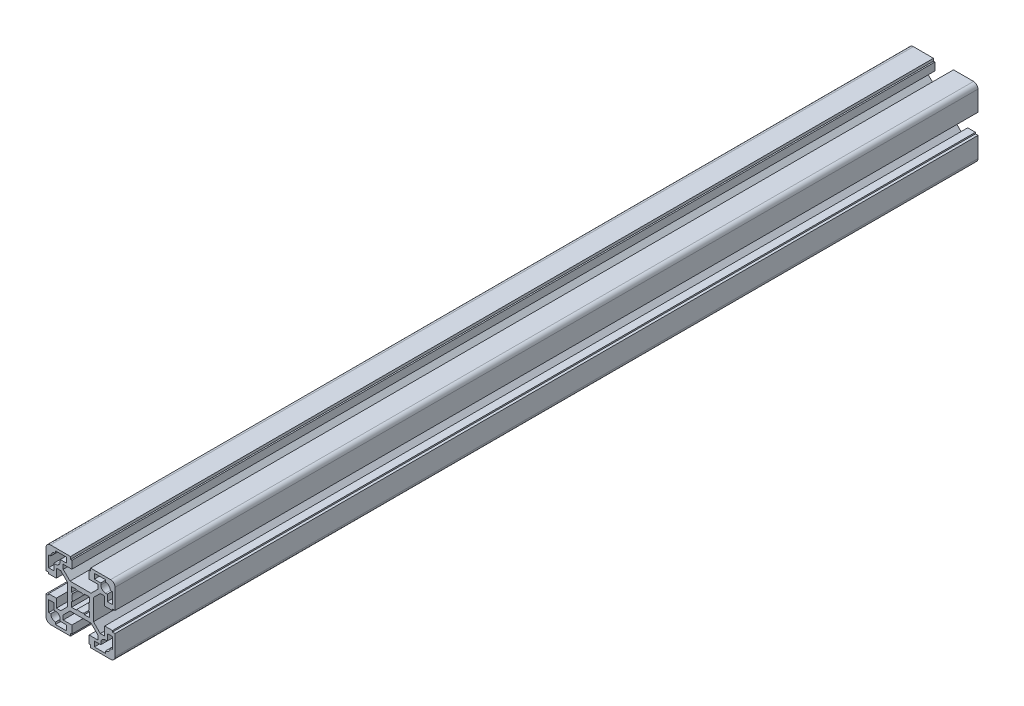
from build123d import *

# Parameters (mm, degrees)
ESTRUSIONE_ESTRUSIONE1_DEPTH = 500


with BuildPart() as part:
    # Schizzo1 → Estrusione-Estrusione1 (new body)
    with BuildSketch(Plane.XY):
        with BuildLine():
            Line((-5, 18.5), (-5, 14))
            Line((-5, 14), (-10.058726211, 14))
            Line((-10.058726211, 14), (-10.058726211, 11.46))
            Line((-10.058726211, 11.46), (-6.085, 7.5))
            Line((-6.085, 7.5), (6.085, 7.5))
            Line((6.085, 7.5), (10.058726211, 11.46))
            Line((10.058726211, 11.46), (10.058726211, 14))
            Line((10.058726211, 14), (5, 14))
            Line((5, 14), (5, 18.5))
            Line((5, 18.5), (5.8, 18.5))
            Line((5.8, 18.5), (5.8, 20))
            Line((5.8, 20), (17.4314, 20))
            ThreePointArc((17.4314, 20), (19.247674478, 19.247674478), (20, 17.4314))
            Line((20, 17.4314), (20, 5.8))
            Line((20, 5.8), (18.5, 5.8))
            Line((18.5, 5.8), (18.5, 5))
            Line((18.5, 5), (14, 5))
            Line((14, 5), (14, 10.058726211))
            Line((14, 10.058726211), (11.46, 10.058726211))
            Line((11.46, 10.058726211), (7.5, 6.085))
            Line((7.5, 6.085), (7.5, -6.085))
            Line((7.5, -6.085), (11.46, -10.058726211))
            Line((11.46, -10.058726211), (14, -10.058726211))
            Line((14, -10.058726211), (14, -5))
            Line((14, -5), (18.5, -5))
            Line((18.5, -5), (18.5, -5.8))
            Line((18.5, -5.8), (20, -5.8))
            Line((20, -5.8), (20, -17.4314))
            ThreePointArc((20, -17.4314), (19.247674478, -19.247674478), (17.4314, -20))
            Line((17.4314, -20), (5.8, -20))
            Line((5.8, -20), (5.8, -18.5))
            Line((5.8, -18.5), (5, -18.5))
            Line((5, -18.5), (5, -14))
            Line((5, -14), (10.058726211, -14))
            Line((10.058726211, -14), (10.058726211, -11.46))
            Line((10.058726211, -11.46), (6.085, -7.5))
            Line((6.085, -7.5), (-6.085, -7.5))
            Line((-6.085, -7.5), (-10.058726211, -11.46))
            Line((-10.058726211, -11.46), (-10.058726211, -14))
            Line((-10.058726211, -14), (-5, -14))
            Line((-5, -14), (-5, -18.5))
            Line((-5, -18.5), (-5.8, -18.5))
            Line((-5.8, -18.5), (-5.8, -20))
            Line((-5.8, -20), (-17.4314, -20))
            ThreePointArc((-17.4314, -20), (-19.247674478, -19.247674478), (-20, -17.4314))
            Line((-20, -17.4314), (-20, -5.8))
            Line((-20, -5.8), (-18.5, -5.8))
            Line((-18.5, -5.8), (-18.5, -5))
            Line((-18.5, -5), (-14, -5))
            Line((-14, -5), (-14, -10.058726211))
            Line((-14, -10.058726211), (-11.46, -10.058726211))
            Line((-11.46, -10.058726211), (-7.5, -6.085))
            Line((-7.5, -6.085), (-7.5, 6.085))
            Line((-7.5, 6.085), (-11.46, 10.058726211))
            Line((-11.46, 10.058726211), (-14, 10.058726211))
            Line((-14, 10.058726211), (-14, 5))
            Line((-14, 5), (-18.5, 5))
            Line((-18.5, 5), (-18.5, 5.8))
            Line((-18.5, 5.8), (-20, 5.8))
            Line((-20, 5.8), (-20, 17.4314))
            ThreePointArc((-20, 17.4314), (-19.247674478, 19.247674478), (-17.4314, 20))
            Line((-17.4314, 20), (-5.8, 20))
            Line((-5.8, 20), (-5.8, 18.5))
            Line((-5.8, 18.5), (-5, 18.5))
        make_face()
        with BuildLine():
            Line((-5.2, 5.2), (-2.26, 5.2))
            Line((-2.26, 5.2), (-1.992985622, 4.585630634))
            ThreePointArc((-1.992985622, 4.585630634), (0, 5), (1.992985622, 4.585630634))
            Line((1.992985622, 4.585630634), (2.26, 5.2))
            Line((2.26, 5.2), (5.2, 5.2))
            Line((5.2, 5.2), (5.2, 2.26))
            Line((5.2, 2.26), (4.585630634, 1.992985622))
            ThreePointArc((4.585630634, 1.992985622), (5, 0), (4.585630634, -1.992985622))
            Line((4.585630634, -1.992985622), (5.2, -2.26))
            Line((5.2, -2.26), (5.2, -5.2))
            Line((5.2, -5.2), (2.26, -5.2))
            Line((2.26, -5.2), (1.992985622, -4.585630634))
            ThreePointArc((1.992985622, -4.585630634), (0, -5), (-1.992985622, -4.585630634))
            Line((-1.992985622, -4.585630634), (-2.26, -5.2))
            Line((-2.26, -5.2), (-5.2, -5.2))
            Line((-5.2, -5.2), (-5.2, -2.26))
            Line((-5.2, -2.26), (-4.585630634, -1.992985622))
            ThreePointArc((-4.585630634, -1.992985622), (-5, 0), (-4.585630634, 1.992985622))
            Line((-4.585630634, 1.992985622), (-5.2, 2.26))
            Line((-5.2, 2.26), (-5.2, 5.2))
        make_face(mode=Mode.SUBTRACT)
        with BuildLine():
            Line((-11.75, 15.5), (-11.75, 14.5))
            ThreePointArc((-11.75, 14.5), (-12.555456352, 12.555456352), (-14.5, 11.75))
            Line((-14.5, 11.75), (-15.5, 11.75))
            Line((-15.5, 11.75), (-15.5, 8))
            Line((-15.5, 8), (-18.5, 8))
            Line((-18.5, 8), (-18.5, 14.5))
            Line((-18.5, 14.5), (-17.25, 14.5))
            ThreePointArc((-17.25, 14.5), (-16.444543648, 16.444543648), (-14.5, 17.25))
            Line((-14.5, 17.25), (-14.5, 18.5))
            Line((-14.5, 18.5), (-8, 18.5))
            Line((-8, 18.5), (-8, 15.5))
            Line((-8, 15.5), (-11.75, 15.5))
        make_face(mode=Mode.SUBTRACT)
        with BuildLine():
            Line((15.5, 11.75), (14.5, 11.75))
            ThreePointArc((14.5, 11.75), (12.555456352, 12.555456352), (11.75, 14.5))
            Line((11.75, 14.5), (11.75, 15.5))
            Line((11.75, 15.5), (8, 15.5))
            Line((8, 15.5), (8, 18.5))
            Line((8, 18.5), (14.5, 18.5))
            Line((14.5, 18.5), (14.5, 17.25))
            ThreePointArc((14.5, 17.25), (16.444543648, 16.444543648), (17.25, 14.5))
            Line((17.25, 14.5), (18.5, 14.5))
            Line((18.5, 14.5), (18.5, 8))
            Line((18.5, 8), (15.5, 8))
            Line((15.5, 8), (15.5, 11.75))
        make_face(mode=Mode.SUBTRACT)
        with BuildLine():
            Line((11.75, -15.5), (11.75, -14.5))
            ThreePointArc((11.75, -14.5), (12.555456352, -12.555456352), (14.5, -11.75))
            Line((14.5, -11.75), (15.5, -11.75))
            Line((15.5, -11.75), (15.5, -8))
            Line((15.5, -8), (18.5, -8))
            Line((18.5, -8), (18.5, -14.5))
            Line((18.5, -14.5), (17.25, -14.5))
            ThreePointArc((17.25, -14.5), (16.444543648, -16.444543648), (14.5, -17.25))
            Line((14.5, -17.25), (14.5, -18.5))
            Line((14.5, -18.5), (8, -18.5))
            Line((8, -18.5), (8, -15.5))
            Line((8, -15.5), (11.75, -15.5))
        make_face(mode=Mode.SUBTRACT)
        with BuildLine():
            Line((-15.5, -11.75), (-14.5, -11.75))
            ThreePointArc((-14.5, -11.75), (-12.555456352, -12.555456352), (-11.75, -14.5))
            Line((-11.75, -14.5), (-11.75, -15.5))
            Line((-11.75, -15.5), (-8, -15.5))
            Line((-8, -15.5), (-8, -18.5))
            Line((-8, -18.5), (-14.5, -18.5))
            Line((-14.5, -18.5), (-14.5, -17.25))
            ThreePointArc((-14.5, -17.25), (-16.444543648, -16.444543648), (-17.25, -14.5))
            Line((-17.25, -14.5), (-18.5, -14.5))
            Line((-18.5, -14.5), (-18.5, -8))
            Line((-18.5, -8), (-15.5, -8))
            Line((-15.5, -8), (-15.5, -11.75))
        make_face(mode=Mode.SUBTRACT)
    extrude(amount=ESTRUSIONE_ESTRUSIONE1_DEPTH)


solid = part.part
